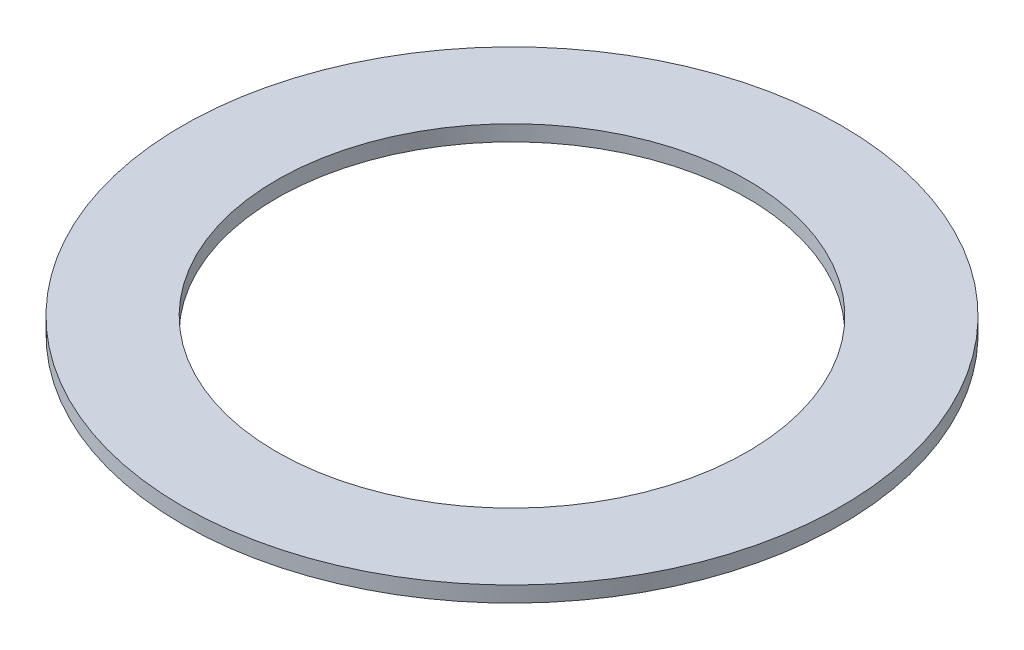
from build123d import *

# Parameters (mm, degrees)
SKETCH2_R           = 21
SKETCH2_R_2         = 15
BOSS_EXTRUDE1_DEPTH = 1


with BuildPart() as part:
    # Sketch2 → Boss-Extrude1 (new body)
    with BuildSketch(Plane(origin=(0, 0, 0), x_dir=(1, 0, 0), z_dir=(0, 1, 0))):
        with Locations(Location((0, 0, 0), (0, 0, 270))):
            Circle(SKETCH2_R)
        with Locations(Location((0, 0, 0), (0, 0, 270))):
            Circle(SKETCH2_R_2, mode=Mode.SUBTRACT)
    extrude(amount=BOSS_EXTRUDE1_DEPTH)


solid = part.part
